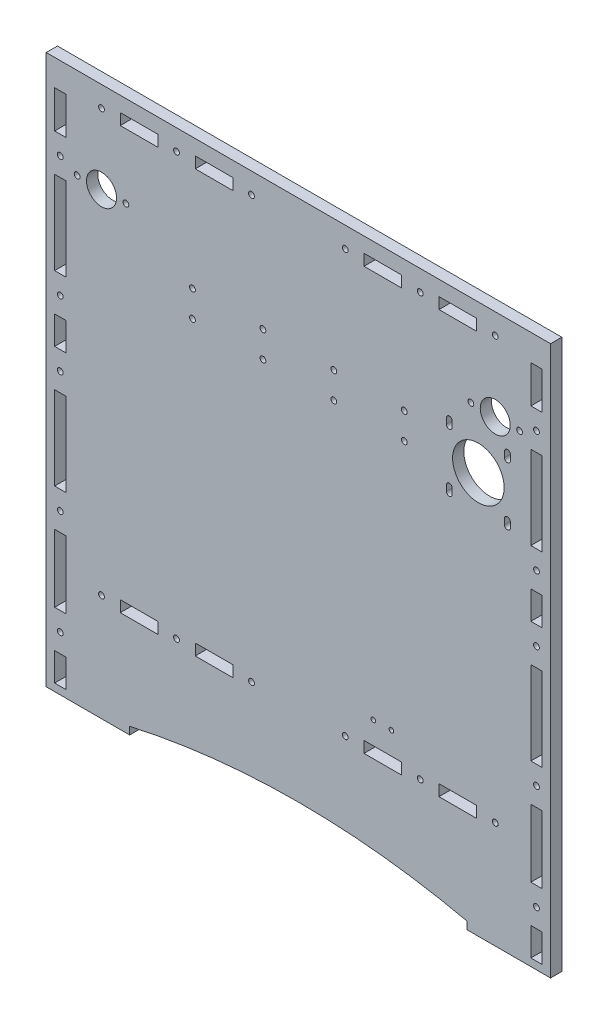
from build123d import *

# Parameters (mm, degrees)
SKETCH1_W           = 260
SKETCH1_H           = 270
BOSS_EXTRUDE1_DEPTH = 6
SKETCH2_W           = 20
SKETCH2_H           = 6
CUT_EXTRUDE1_DEPTH  = 6
SKETCH4_W           = 6
SKETCH4_H           = 44.5
SKETCH4_H_2         = 15
SKETCH4_H_3         = 36
CUT_EXTRUDE3_DEPTH  = 6
SKETCH5_R           = 8
CUT_EXTRUDE4_DEPTH  = 10
SKETCH6_R           = 8
SKETCH6_R_2         = 1.55
CUT_EXTRUDE5_DEPTH  = 6
SKETCH7_R           = 1.55
CUT_EXTRUDE6_DEPTH  = 10
SKETCH8_W           = 248
SKETCH8_H           = 6
BOSS_EXTRUDE2_DEPTH = 5
SKETCH9_W           = 4.5
SKETCH9_H           = 275
BOSS_EXTRUDE5_DEPTH = 6
SKETCH10_R          = 13.75
CUT_EXTRUDE7_DEPTH  = 6
SKETCH11_R          = 1.55
CUT_EXTRUDE8_DEPTH  = 6
SKETCH12_R          = 1.55
CUT_EXTRUDE9_DEPTH  = 10
SKETCH13_W          = 44.5
SKETCH13_H          = 6
BOSS_EXTRUDE6_DEPTH = 4
SKETCH14_W          = 269
SKETCH14_H          = 6
BOSS_EXTRUDE7_DEPTH = 14
SKETCH15_R          = 1.55
SKETCH15_W          = 20
SKETCH15_H          = 6
CUT_EXTRUDE10_DEPTH = 10
SKETCH16_R          = 1.25
CUT_EXTRUDE11_DEPTH = 10


with BuildPart() as part:
    # Sketch1 → Boss-Extrude1 (new body)
    with BuildSketch(Plane.XY):
        with Locations((130, 135)):
            Rectangle(SKETCH1_W, SKETCH1_H)
    extrude(amount=BOSS_EXTRUDE1_DEPTH)

    # Sketch2 → Cut-Extrude1 (cut)
    with BuildSketch(Plane(origin=(0, 0, 0), x_dir=(-1, 0, 0), z_dir=(0, 0, -1))):
        with Locations((-215, 53)):
            Rectangle(SKETCH2_W, SKETCH2_H)
        with Locations((-175, 53)):
            Rectangle(SKETCH2_W, SKETCH2_H)
        with BuildLine():
            Line((-220, 0), (-40, 0))
            ThreePointArc((-40, 0), (-130, 10), (-220, 0))
        make_face()
        with Locations((-85, 53)):
            Rectangle(SKETCH2_W, SKETCH2_H)
        with Locations((-45, 53)):
            Rectangle(SKETCH2_W, SKETCH2_H)
    extrude(amount=-CUT_EXTRUDE1_DEPTH, mode=Mode.SUBTRACT)

    # Sketch4 → Cut-Extrude3 (cut)
    with BuildSketch(Plane(origin=(0, 0, 0), x_dir=(-1, 0, 0), z_dir=(0, 0, -1))):
        Polygon((-254, 270), (-260, 270), (-260, 264), (-260, 255), (-254, 255), (-254, 264), align=None)
        with Locations((-257, 212.75)):
            Rectangle(SKETCH4_W, SKETCH4_H)
        with Locations((-257, 163)):
            Rectangle(SKETCH4_W, SKETCH4_H_2)
        with Locations((-257, 113.25)):
            Rectangle(SKETCH4_W, SKETCH4_H)
        with Locations((-257, 53)):
            Rectangle(SKETCH4_W, SKETCH4_H_3)
        with Locations((-257, 7.5)):
            Rectangle(SKETCH4_W, SKETCH4_H_2)
        with Locations((-3, 7.5)):
            Rectangle(SKETCH4_W, SKETCH4_H_2)
        with Locations((-3, 53)):
            Rectangle(SKETCH4_W, SKETCH4_H_3)
        with Locations((-3, 113.25)):
            Rectangle(SKETCH4_W, SKETCH4_H)
        with Locations((-3, 212.75)):
            Rectangle(SKETCH4_W, SKETCH4_H)
        with Locations((-3, 262.5)):
            Rectangle(SKETCH4_W, SKETCH4_H_2)
        with Locations((-3, 163)):
            Rectangle(SKETCH4_W, SKETCH4_H_2)
    extrude(amount=-CUT_EXTRUDE3_DEPTH, mode=Mode.SUBTRACT)

    # Sketch5 → Cut-Extrude4 (cut)
    with BuildSketch(Plane(origin=(0, 0, 0), x_dir=(-1, 0, 0), z_dir=(0, 0, -1))):
        with Locations((-235, 240.5)):
            Circle(SKETCH5_R)
        with Locations((-25, 240.5)):
            Circle(SKETCH5_R)
    extrude(amount=-CUT_EXTRUDE4_DEPTH, mode=Mode.SUBTRACT)

    # Sketch6 → Cut-Extrude5 (cut)
    with BuildSketch(Plane(origin=(0, 0, 0), x_dir=(-1, 0, 0), z_dir=(0, 0, -1))):
        with Locations((-235, 240.5)):
            Circle(SKETCH6_R)
        with Locations((-248, 240.5)):
            Circle(SKETCH6_R_2)
        with Locations(Location((-222, 240.5, 0), (0, 0, 180))):
            Circle(SKETCH6_R_2)
        with Locations(Location((-12, 240.5, 0), (0, 0, 180))):
            Circle(SKETCH6_R_2)
        with Locations((-38, 240.5)):
            Circle(SKETCH6_R_2)
    extrude(amount=-CUT_EXTRUDE5_DEPTH, mode=Mode.SUBTRACT)

    # Sketch7 → Cut-Extrude6 (cut)
    with BuildSketch(Plane(origin=(0, 0, 0), x_dir=(-1, 0, 0), z_dir=(0, 0, -1))):
        with Locations((-186.5, 205)):
            Circle(SKETCH7_R)
        with Locations((-148.9, 205)):
            Circle(SKETCH7_R)
        with Locations((-148.9, 219)):
            Circle(SKETCH7_R)
        with Locations((-186.5, 219)):
            Circle(SKETCH7_R)
        with Locations((-73.5, 205)):
            Circle(SKETCH7_R)
        with Locations((-111.1, 205)):
            Circle(SKETCH7_R)
        with Locations((-111.1, 219)):
            Circle(SKETCH7_R)
        with Locations((-73.5, 219)):
            Circle(SKETCH7_R)
    extrude(amount=-CUT_EXTRUDE6_DEPTH, mode=Mode.SUBTRACT)

    # Sketch8 → Boss-Extrude2 (add)
    with BuildSketch(Plane(origin=(0, 270, 0), x_dir=(1, 0, 0), z_dir=(0, 1, 0))):
        with Locations((130, -3)):
            Rectangle(SKETCH8_W, SKETCH8_H)
    extrude(amount=BOSS_EXTRUDE2_DEPTH)

    # Sketch9 → Boss-Extrude5 (add)
    with BuildSketch(Plane(origin=(0, 0, 0), x_dir=(-1, 0, 0), z_dir=(0, 0, -1))):
        with Locations((2.25, 137.5)):
            Rectangle(SKETCH9_W, SKETCH9_H)
        with Locations((-262.25, 137.5)):
            Rectangle(SKETCH9_W, SKETCH9_H)
    extrude(amount=-BOSS_EXTRUDE5_DEPTH)

    # Sketch10 → Cut-Extrude7 (cut)
    with BuildSketch(Plane.XY.offset(6)):
        with Locations((226, 210.052298937)):
            Circle(SKETCH10_R)
        with BuildLine():
            Line((208.95, 224.052298937), (208.95, 227.052298937))
            ThreePointArc((208.95, 227.052298937), (210.5, 228.602298937), (212.05, 227.052298937))
            Line((212.05, 227.052298937), (212.05, 224.052298937))
            ThreePointArc((212.05, 224.052298937), (210.5, 222.502298937), (208.95, 224.052298937))
        make_face()
        with BuildLine():
            Line((243.05, 224.052298937), (243.05, 227.052298937))
            ThreePointArc((243.05, 227.052298937), (241.5, 228.602298937), (239.95, 227.052298937))
            Line((239.95, 227.052298937), (239.95, 224.052298937))
            ThreePointArc((239.95, 224.052298937), (241.5, 222.502298937), (243.05, 224.052298937))
        make_face()
        with BuildLine():
            Line((243.05, 193.052298937), (243.05, 196.052298937))
            ThreePointArc((243.05, 196.052298937), (241.5, 197.602298937), (239.95, 196.052298937))
            Line((239.95, 196.052298937), (239.95, 193.052298937))
            ThreePointArc((239.95, 193.052298937), (241.5, 191.502298937), (243.05, 193.052298937))
        make_face()
        with BuildLine():
            Line((212.05, 193.052298937), (212.05, 196.052298937))
            ThreePointArc((212.05, 196.052298937), (210.5, 197.602298937), (208.95, 196.052298937))
            Line((208.95, 196.052298937), (208.95, 193.052298937))
            ThreePointArc((208.95, 193.052298937), (210.5, 191.502298937), (212.05, 193.052298937))
        make_face()
    extrude(amount=-CUT_EXTRUDE7_DEPTH, mode=Mode.SUBTRACT)

    # Sketch11 → Cut-Extrude8 (cut)
    with BuildSketch(Plane.XY.offset(6)):
        with Locations((3, 245)):
            Circle(SKETCH11_R)
        with Locations((3, 180.5)):
            Circle(SKETCH11_R)
        with Locations((3, 145.5)):
            Circle(SKETCH11_R)
        with Locations((3, 81)):
            Circle(SKETCH11_R)
        with Locations((3, 25)):
            Circle(SKETCH11_R)
        with Locations(Location((257, 25, 0), (0, 0, 180))):
            Circle(SKETCH11_R)
        with Locations(Location((257, 81, 0), (0, 0, 180))):
            Circle(SKETCH11_R)
        with Locations(Location((257, 145.5, 0), (0, 0, 180))):
            Circle(SKETCH11_R)
        with Locations(Location((257, 180.5, 0), (0, 0, 180))):
            Circle(SKETCH11_R)
        with Locations(Location((257, 245, 0), (0, 0, 180))):
            Circle(SKETCH11_R)
    extrude(amount=-CUT_EXTRUDE8_DEPTH, mode=Mode.SUBTRACT)

    # Sketch12 → Cut-Extrude9 (cut)
    with BuildSketch(Plane.XY.offset(6)):
        with Locations((25, 53)):
            Circle(SKETCH12_R)
        with Locations((65, 53)):
            Circle(SKETCH12_R)
        with Locations((105, 53)):
            Circle(SKETCH12_R)
        with Locations(Location((155, 53, 0), (0, 0, 180))):
            Circle(SKETCH12_R)
        with Locations(Location((195, 53, 0), (0, 0, 180))):
            Circle(SKETCH12_R)
        with Locations(Location((235, 53, 0), (0, 0, 180))):
            Circle(SKETCH12_R)
    extrude(amount=-CUT_EXTRUDE9_DEPTH, mode=Mode.SUBTRACT)

    # Sketch13 → Boss-Extrude6 (add)
    with BuildSketch(Plane.XZ):
        with Locations((17.75, 3)):
            Rectangle(SKETCH13_W, SKETCH13_H)
        with Locations((242.25, 3)):
            Rectangle(SKETCH13_W, SKETCH13_H)
    extrude(amount=BOSS_EXTRUDE6_DEPTH)

    # Sketch14 → Boss-Extrude7 (add)
    with BuildSketch(Plane(origin=(0, 275, 0), x_dir=(1, 0, 0), z_dir=(0, 1, 0))):
        with Locations((130, -3)):
            Rectangle(SKETCH14_W, SKETCH14_H)
    extrude(amount=BOSS_EXTRUDE7_DEPTH)

    # Sketch15 → Cut-Extrude10 (cut)
    with BuildSketch(Plane.XY.offset(6)):
        with Locations((25, 278)):
            Circle(SKETCH15_R)
        with Locations((65, 278)):
            Circle(SKETCH15_R)
        with Locations((105, 278)):
            Circle(SKETCH15_R)
        with Locations((155, 278)):
            Circle(SKETCH15_R)
        with Locations((195, 278)):
            Circle(SKETCH15_R)
        with Locations((235, 278)):
            Circle(SKETCH15_R)
        with Locations((45, 278)):
            Rectangle(SKETCH15_W, SKETCH15_H)
        with Locations((85, 278)):
            Rectangle(SKETCH15_W, SKETCH15_H)
        with Locations((175, 278)):
            Rectangle(SKETCH15_W, SKETCH15_H)
        with Locations((215, 278)):
            Rectangle(SKETCH15_W, SKETCH15_H)
    extrude(amount=-CUT_EXTRUDE10_DEPTH, mode=Mode.SUBTRACT)

    # Sketch16 → Cut-Extrude11 (cut)
    with BuildSketch(Plane.XY.offset(6)):
        with Locations((179.6, 68)):
            Circle(SKETCH16_R)
        with Locations((170, 68)):
            Circle(SKETCH16_R)
    extrude(amount=-CUT_EXTRUDE11_DEPTH, mode=Mode.SUBTRACT)


solid = part.part
